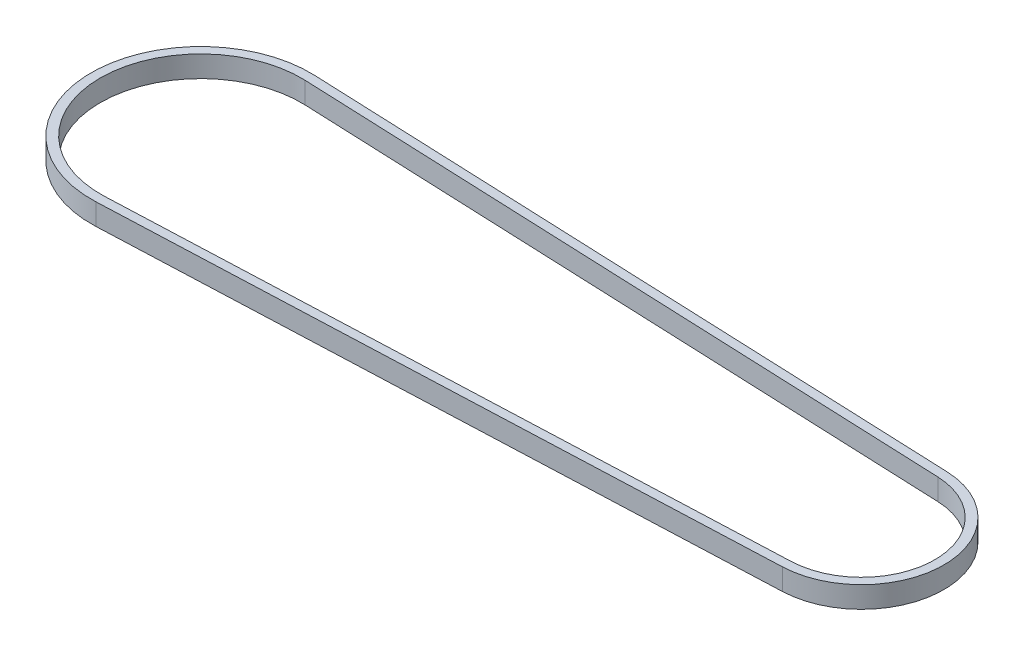
from build123d import *

# Parameters (mm, degrees)
BOSS_EXTRUDE1_DEPTH = 6


with BuildPart() as part:
    # Sketch1 → Boss-Extrude1 (new body)
    with BuildSketch(Plane(origin=(0, 0, 0), x_dir=(1, 0, 0), z_dir=(0, 1, 0))):
        with BuildLine():
            Line((186.369890411, -23.094473456), (1.263041096, -30.708036134))
            ThreePointArc((1.263041096, -30.708036134), (-30.734, 0), (1.263041096, 30.708036134))
            Line((1.263041096, 30.708036134), (186.369890411, 23.094473456))
            ThreePointArc((186.369890411, 23.094473456), (208.534, 0), (186.369890411, -23.094473456))
        make_face()
        with BuildLine():
            Line((186.265506849, -20.55661923), (1.158657534, -28.170181908))
            ThreePointArc((1.158657534, -28.170181908), (-28.194, 0), (1.158657534, 28.170181908))
            Line((1.158657534, 28.170181908), (186.265506849, 20.55661923))
            ThreePointArc((186.265506849, 20.55661923), (205.994, 0), (186.265506849, -20.55661923))
        make_face(mode=Mode.SUBTRACT)
    extrude(amount=BOSS_EXTRUDE1_DEPTH)


solid = part.part
